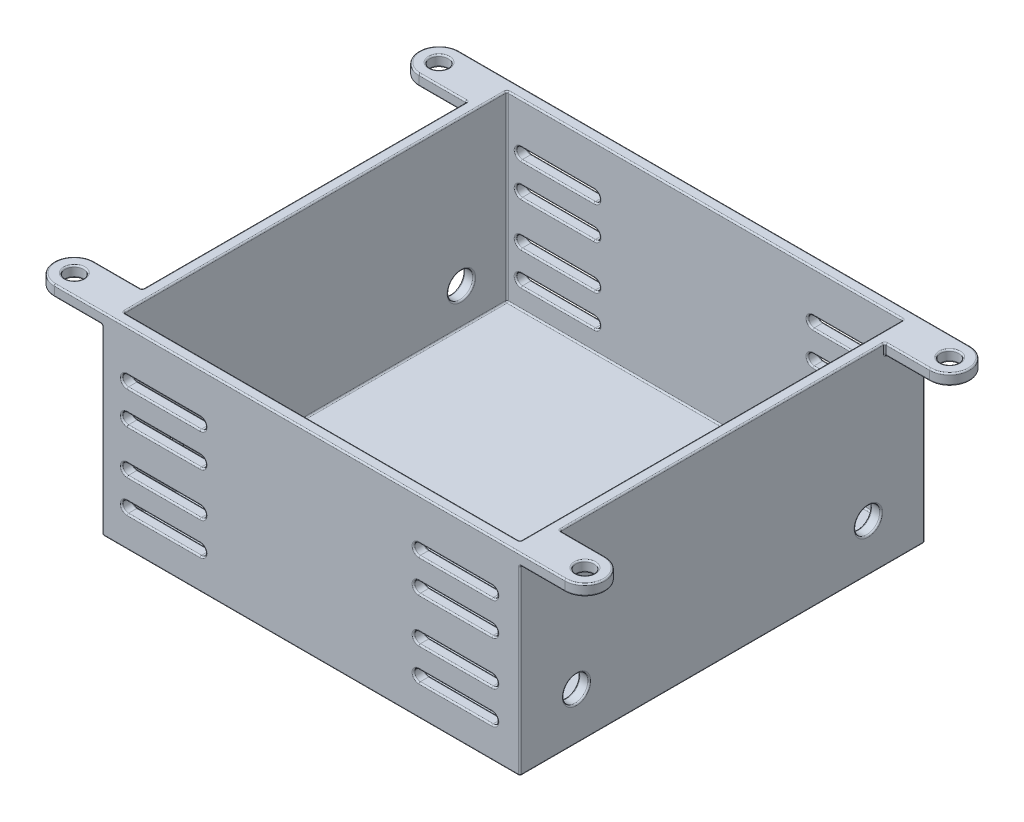
from build123d import *

# Parameters (mm, degrees)
SKETCH2_W               = 57.293889142
SKETCH2_H               = 55.5
SKETCH2_W_2             = 54.293889142
SKETCH2_H_2             = 52.5
BOSS_EXTRUDE1_DEPTH     = 25
SKETCH3_W               = 57.293889142
SKETCH3_H               = 55.5
BOSS_EXTRUDE2_DEPTH     = 1.5
SKETCH4_R               = 1.25
BOSS_EXTRUDE3_DEPTH     = 1.5
CUT_EXTRUDE1_DEPTH      = 54.82727004
CUT_EXTRUDE1_DEPTH_BACK = 54.82727004
CUT_EXTRUDE2_DEPTH      = 31.5
CUT_EXTRUDE2_DEPTH_BACK = 31.5
SKETCH6_R               = 1.75
FILLET1_R               = 0.2


with BuildPart() as part:
    # Sketch2 → Boss-Extrude1 (new body)
    with BuildSketch(Plane(origin=(0, 0, 0), x_dir=(1, 0, 0), z_dir=(0, 1, 0))):
        with Locations((0.197612573, 0)):
            Rectangle(SKETCH2_W, SKETCH2_H)
        with Locations((0.197612573, 0)):
            Rectangle(SKETCH2_W_2, SKETCH2_H_2, mode=Mode.SUBTRACT)
    extrude(amount=-BOSS_EXTRUDE1_DEPTH)

    # Sketch3 → Boss-Extrude2 (add)
    with BuildSketch(Plane.XZ.offset(25)):
        with Locations((0.197612573, 0)):
            Rectangle(SKETCH3_W, SKETCH3_H)
    extrude(amount=BOSS_EXTRUDE2_DEPTH)

    # Sketch4 → Boss-Extrude3 (add)
    # profile 1 of 4: a face of its own
    with BuildSketch(Plane(origin=(0, 0, 0), x_dir=(1, 0, 0), z_dir=(0, 1, 0))):
        with BuildLine():
            Line((-28.449331998, -27.75), (-28.449331998, -22.25))
            Line((-28.449331998, -22.25), (-35, -22.25))
            ThreePointArc((-35, -22.25), (-37.75, -25), (-35, -27.75))
            Line((-35, -27.75), (-28.449331998, -27.75))
        make_face()
        with Locations(Location((-35, -25, 0), (0, 0, 270))):
            Circle(SKETCH4_R, mode=Mode.SUBTRACT)
    # profile 2 of 4: a face of its own
    with BuildSketch(Plane(origin=(0, 0, 0), x_dir=(1, 0, 0), z_dir=(0, 1, 0))):
        with BuildLine():
            Line((-28.449331998, 22.25), (-28.449331998, 27.75))
            Line((-28.449331998, 27.75), (-35, 27.75))
            ThreePointArc((-35, 27.75), (-37.75, 25), (-35, 22.25))
            Line((-35, 22.25), (-28.449331998, 22.25))
        make_face()
        with Locations(Location((-35, 25, 0), (0, 0, 270))):
            Circle(SKETCH4_R, mode=Mode.SUBTRACT)
    # profile 3 of 4: a face of its own
    with BuildSketch(Plane(origin=(0, 0, 0), x_dir=(1, 0, 0), z_dir=(0, 1, 0))):
        with BuildLine():
            Line((28.844557144, 27.75), (28.844557144, 22.25))
            Line((28.844557144, 22.25), (35, 22.25))
            ThreePointArc((35, 22.25), (37.75, 25), (35, 27.75))
            Line((35, 27.75), (28.844557144, 27.75))
        make_face()
        with Locations(Location((35, 25, 0), (0, 0, 270))):
            Circle(SKETCH4_R, mode=Mode.SUBTRACT)
    # profile 4 of 4: a face of its own
    with BuildSketch(Plane(origin=(0, 0, 0), x_dir=(1, 0, 0), z_dir=(0, 1, 0))):
        with BuildLine():
            ThreePointArc((35, -27.75), (37.75, -25), (35, -22.25))
            Line((35, -22.25), (28.844557144, -22.25))
            Line((28.844557144, -22.25), (28.844557144, -27.75))
            Line((28.844557144, -27.75), (35, -27.75))
        make_face()
        with Locations(Location((35, -25, 0), (0, 0, 270))):
            Circle(SKETCH4_R, mode=Mode.SUBTRACT)
    extrude(amount=-BOSS_EXTRUDE3_DEPTH)

    # Sketch5 → Cut-Extrude1 (cut, two sides: drawn at the far end of the back side and taken through both)
    with BuildSketch(Plane.XY.offset(-CUT_EXTRUDE1_DEPTH_BACK)):
        with BuildLine():
            Line((-25, -5.75), (-15, -5.75))
            ThreePointArc((-15, -5.75), (-14.25, -6.5), (-15, -7.25))
            Line((-15, -7.25), (-25, -7.25))
            ThreePointArc((-25, -7.25), (-25.75, -6.5), (-25, -5.75))
        make_face()
        with BuildLine():
            Line((-25, -10.25), (-15, -10.25))
            ThreePointArc((-15, -10.25), (-14.25, -11), (-15, -11.75))
            Line((-15, -11.75), (-25, -11.75))
            ThreePointArc((-25, -11.75), (-25.75, -11), (-25, -10.25))
        make_face()
        with BuildLine():
            Line((-25, -17.75), (-15, -17.75))
            ThreePointArc((-15, -17.75), (-14.25, -17), (-15, -16.25))
            Line((-15, -16.25), (-25, -16.25))
            ThreePointArc((-25, -16.25), (-25.75, -17), (-25, -17.75))
        make_face()
        with BuildLine():
            Line((-25, -22.25), (-15, -22.25))
            ThreePointArc((-15, -22.25), (-14.25, -21.5), (-15, -20.75))
            Line((-15, -20.75), (-25, -20.75))
            ThreePointArc((-25, -20.75), (-25.75, -21.5), (-25, -22.25))
        make_face()
        with BuildLine():
            Line((25, -5.75), (15, -5.75))
            ThreePointArc((15, -5.75), (14.25, -6.5), (15, -7.25))
            Line((15, -7.25), (25, -7.25))
            ThreePointArc((25, -7.25), (25.75, -6.5), (25, -5.75))
        make_face()
        with BuildLine():
            Line((25, -10.25), (15, -10.25))
            ThreePointArc((15, -10.25), (14.25, -11), (15, -11.75))
            Line((15, -11.75), (25, -11.75))
            ThreePointArc((25, -11.75), (25.75, -11), (25, -10.25))
        make_face()
        with BuildLine():
            Line((25, -17.75), (15, -17.75))
            ThreePointArc((15, -17.75), (14.25, -17), (15, -16.25))
            Line((15, -16.25), (25, -16.25))
            ThreePointArc((25, -16.25), (25.75, -17), (25, -17.75))
        make_face()
        with BuildLine():
            Line((25, -22.25), (15, -22.25))
            ThreePointArc((15, -22.25), (14.25, -21.5), (15, -20.75))
            Line((15, -20.75), (25, -20.75))
            ThreePointArc((25, -20.75), (25.75, -21.5), (25, -22.25))
        make_face()
    extrude(amount=CUT_EXTRUDE1_DEPTH + CUT_EXTRUDE1_DEPTH_BACK, mode=Mode.SUBTRACT)

    # Sketch6 → Cut-Extrude2 (cut, two sides: drawn at the far end of the back side and taken through both)
    with BuildSketch(Plane(origin=(0, 0, 0), x_dir=(0, 0, -1), z_dir=(1, 0, 0)).offset(-CUT_EXTRUDE2_DEPTH_BACK)):
        with Locations(Location((-20, -20, 0), (0, 0, 180))):
            Circle(SKETCH6_R)
        with Locations(Location((20, -20, 0), (0, 0, 180))):
            Circle(SKETCH6_R)
    extrude(amount=CUT_EXTRUDE2_DEPTH + CUT_EXTRUDE2_DEPTH_BACK, mode=Mode.SUBTRACT)

    # Fillet1
    fillet1_edges = [part.edges().sort_by_distance(p)[0] for p in [
        (20, -22.25, -26.25),
        (25.75, -21.5, -26.25),
        (20, -16.25, -26.25),
        (14.25, -17, -26.25),
        (20, -17.75, -26.25),
        (25.75, -17, -26.25),
        (20, -10.25, -26.25),
        (14.25, -11, -26.25),
        (20, -11.75, -26.25),
        (25.75, -11, -26.25),
        (-20, -11.75, -26.25),
        (-14.25, -11, -26.25),
        (-20, -10.25, -26.25),
        (-25.75, -11, -26.25),
        (-20, -17.75, -26.25),
        (-14.25, -17, -26.25),
        (-20, -16.25, -26.25),
        (-25.75, -17, -26.25),
        (-20, -22.25, -26.25),
        (-14.25, -21.5, -26.25),
        (-20, -20.75, -26.25),
        (-25.75, -21.5, -26.25),
        (20, -5.75, -26.25),
        (14.25, -6.5, -26.25),
        (20, -7.25, -26.25),
        (25.75, -6.5, -26.25),
        (27.344557144, -25, 0),
        (27.344557144, -12.5, -26.25),
        (0.197612573, -25, 26.25),
        (27.344557144, -12.5, 26.25),
        (-26.949331998, -25, 0),
        (25.75, -6.5, 27.75),
        (20, -7.25, 27.75),
        (14.25, -6.5, 27.75),
        (-26.949331998, -12.5, 26.25),
        (20, -5.75, 26.25),
        (20, -5.75, -27.75),
        (25.75, -6.5, 26.25),
        (0.197612573, -25, -26.25),
        (20, -7.25, 26.25),
        (14.25, -6.5, 26.25),
        (25.75, -6.5, -27.75),
        (20, -7.25, -27.75),
        (14.25, -6.5, -27.75),
        (20, -5.75, 27.75),
        (-26.949331998, -12.5, -26.25),
        (27.344557144, 0, 0),
        (0.197612573, 0, -26.25),
        (-25.75, -21.5, 27.75),
        (-20, -20.75, 27.75),
        (-26.949331998, 0, 0),
        (-14.25, -21.5, 27.75),
        (-20, -22.25, 26.25),
        (-20, -22.25, -27.75),
        (-25.75, -21.5, 26.25),
        (-20, -20.75, 26.25),
        (-14.25, -21.5, 26.25),
        (-25.75, -21.5, -27.75),
        (-20, -20.75, -27.75),
        (-14.25, -21.5, -27.75),
        (0.197612573, 0, 26.25),
        (-20, -22.25, 27.75),
        (-25.75, -17, 27.75),
        (-20, -16.25, 27.75),
        (-14.25, -17, 27.75),
        (-20, -17.75, 26.25),
        (-20, -17.75, -27.75),
        (-25.75, -17, 26.25),
        (-20, -16.25, 26.25),
        (-14.25, -17, 26.25),
        (-25.75, -17, -27.75),
        (-20, -16.25, -27.75),
        (-14.25, -17, -27.75),
        (-20, -17.75, 27.75),
        (-25.75, -11, 26.25),
        (-25.75, -11, -27.75),
        (-20, -10.25, 27.75),
        (-14.25, -11, 26.25),
        (-14.25, -11, -27.75),
        (-20, -11.75, 26.25),
        (-20, -11.75, -27.75),
        (-20, -10.25, 26.25),
        (-20, -10.25, -27.75),
        (-25.75, -11, 27.75),
        (-20, -11.75, 27.75),
        (-14.25, -11, 27.75),
        (25.75, -11, 27.75),
        (20, -11.75, 27.75),
        (14.25, -11, 27.75),
        (20, -10.25, 26.25),
        (20, -10.25, -27.75),
        (25.75, -11, 26.25),
        (20, -11.75, 26.25),
        (14.25, -11, 26.25),
        (25.75, -11, -27.75),
        (20, -11.75, -27.75),
        (14.25, -11, -27.75),
        (20, -10.25, 27.75),
        (25.75, -17, 26.25),
        (25.75, -17, -27.75),
        (20, -17.75, 27.75),
        (14.25, -17, 26.25),
        (14.25, -17, -27.75),
        (20, -16.25, 26.25),
        (20, -16.25, -27.75),
        (20, -17.75, 26.25),
        (20, -17.75, -27.75),
        (25.75, -17, 27.75),
        (20, -16.25, 27.75),
        (14.25, -17, 27.75),
        (25.75, -21.5, 26.25),
        (25.75, -21.5, -27.75),
        (20, -22.25, 27.75),
        (14.25, -21.5, 26.25),
        (14.25, -21.5, -27.75),
        (20, -20.75, 26.25),
        (20, -20.75, -27.75),
        (20, -22.25, 26.25),
        (20, -22.25, -27.75),
        (25.75, -21.5, 27.75),
        (20, -20.75, 27.75),
        (14.25, -21.5, 27.75),
        (-25.75, -6.5, 26.25),
        (-25.75, -6.5, -27.75),
        (-20, -5.75, 27.75),
        (-14.25, -6.5, 26.25),
        (-14.25, -6.5, -27.75),
        (-20, -7.25, 26.25),
        (-20, -7.25, -27.75),
        (-20, -5.75, 26.25),
        (-20, -5.75, -27.75),
        (-25.75, -6.5, 27.75),
        (-20, -7.25, 27.75),
        (-14.25, -6.5, 27.75),
        (0.197612573, -26.5, -27.75),
        (28.844557144, -26.5, 0),
        (0.197612573, -26.5, 27.75),
        (-28.449331998, -26.5, 0),
        (28.844557144, -20, 18.25),
        (-28.449331998, -20, 18.25),
        (27.344557144, -20, 18.25),
        (-26.949331998, -20, 18.25),
        (28.844557144, -20, -21.75),
        (-28.449331998, -20, -21.75),
        (27.344557144, -20, -21.75),
        (-26.949331998, -20, -21.75),
        (-31.724665999, 0, 22.25),
        (-28.449331998, -0.75, 22.25),
        (-31.724665999, -1.5, 27.75),
        (-35, 0, 23.75),
        (-37.75, -1.5, 25),
        (-35, -1.5, 23.75),
        (-31.724665999, -1.5, 22.25),
        (-28.449331998, -1.5, 25),
        (-37.75, 0, 25),
        (0, 0, -27.75),
        (-28.449331998, 0, 0),
        (-31.724665999, -1.5, -27.75),
        (-31.724665999, -1.5, -22.25),
        (-28.449331998, -0.75, -22.25),
        (-35, 0, -26.25),
        (-37.75, -1.5, -25),
        (0, 0, 27.75),
        (-35, -1.5, -26.25),
        (-28.449331998, -1.5, -25),
        (-37.75, 0, -25),
        (-31.724665999, 0, -22.25),
        (31.922278572, 0, -22.25),
        (28.844557144, -0.75, -22.25),
        (35, 0, -26.25),
        (37.75, -1.5, -25),
        (35, -1.5, -26.25),
        (31.922278572, -1.5, -22.25),
        (28.844557144, -1.5, -25),
        (31.922278572, -1.5, -27.75),
        (37.75, 0, -25),
        (-28.449331998, -14, -27.75),
        (28.844557144, 0, 0),
        (28.844557144, -14, -27.75),
        (28.844557144, -14, 27.75),
        (31.922278572, -1.5, 27.75),
        (31.922278572, -1.5, 22.25),
        (-28.449331998, -14, 27.75),
        (28.844557144, -0.75, 22.25),
        (35, 0, 23.75),
        (37.75, -1.5, 25),
        (35, -1.5, 23.75),
        (28.844557144, -1.5, 25),
        (37.75, 0, 25),
        (31.922278572, 0, 22.25),
        (-20, -7.25, -26.25),
        (-14.25, -6.5, -26.25),
        (-20, -5.75, -26.25),
        (-25.75, -6.5, -26.25),
        (20, -20.75, -26.25),
        (14.25, -21.5, -26.25),
    ]]
    fillet(fillet1_edges, radius=FILLET1_R)


solid = part.part
